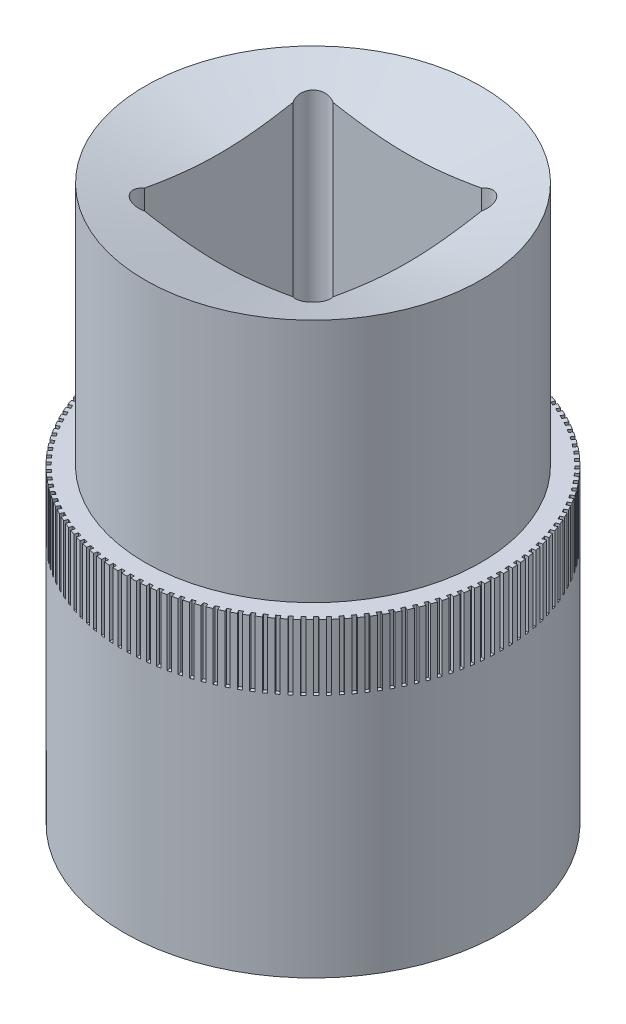
from build123d import *

# Parameters (mm, degrees)
CUT_EXTRUDE1_DEPTH        = 16
CUT_EXTRUDE2_DEPTH        = 18.5
CUT_EXTRUDE3_REACH        = 28.615
CUT_EXTRUDE3_START_RADIUS = 12.925
CUT_EXTRUDE3_END_RADIUS   = 12.925
SKETCH4_W                 = 0.25
SKETCH4_H                 = 4.5
CIRPATTERN1_COUNT         = 130


with BuildPart() as part:
    # Sketch1 → Revolve1 (revolve)
    with BuildSketch(Plane(origin=(0, 0, 0), x_dir=(0, 0, -1), z_dir=(1, 0, 0)), mode=Mode.PRIVATE) as revolve1_sk:
        Polygon((11.5, 19), (11.5, 2.25), (12.925, 2.25), (12.925, -19), (10, -19), (10, -0.8), (6.45, -0.8), (6.45, 17.5), align=None)
    revolve(revolve1_sk.sketch.rotate(Axis((0, 19, 0), (0, -1, 0)), 180), axis=Axis((0, 19, 0), (0, -1, 0)))

    # Sketch2 → Cut-Extrude1 (cut)
    with BuildSketch(Plane(origin=(0, 19, 0), x_dir=(1, 0, 0), z_dir=(0, 1, 0))):
        with BuildLine():
            Line((-5.082405474, 6.45), (5.082405474, 6.45))
            ThreePointArc((5.082405474, 6.45), (6.293250353, 6.293250353), (6.45, 5.082405474))
            Line((6.45, 5.082405474), (6.45, -5.082405474))
            ThreePointArc((6.45, -5.082405474), (6.293250353, -6.293250353), (5.082405474, -6.45))
            Line((5.082405474, -6.45), (-5.082405474, -6.45))
            ThreePointArc((-5.082405474, -6.45), (-6.293250353, -6.293250353), (-6.45, -5.082405474))
            Line((-6.45, -5.082405474), (-6.45, 5.082405474))
            ThreePointArc((-6.45, 5.082405474), (-6.293250353, 6.293250353), (-5.082405474, 6.45))
        make_face()
    extrude(amount=-CUT_EXTRUDE1_DEPTH, mode=Mode.SUBTRACT)

    # Sketch3 → Cut-Extrude2 (cut)
    with BuildSketch(Plane.XZ.offset(19)):
        Polygon((11.1, 0), (9.612881982, 2.575763964), (9.612881982, 5.55), (7.037118018, 7.037118018), (5.55, 9.612881982), (2.575763964, 9.612881982), (0, 11.1), (-2.575763964, 9.612881982), (-5.55, 9.612881982), (-7.037118018, 7.037118018), (-9.612881982, 5.55), (-9.612881982, 2.575763964), (-11.1, 0), (-9.612881982, -2.575763964), (-9.612881982, -5.55), (-7.037118018, -7.037118018), (-5.55, -9.612881982), (-2.575763964, -9.612881982), (0, -11.1), (2.575763964, -9.612881982), (5.55, -9.612881982), (7.037118018, -7.037118018), (9.612881982, -5.55), (9.612881982, -2.575763964), align=None)
    extrude(amount=-CUT_EXTRUDE2_DEPTH, mode=Mode.SUBTRACT)

    # Cut-Extrude3: from a cylinder face, 28.615 long prism both ways, kept between that surface and its translate by the depth
    cut_extrude3_start = Plane(origin=(0, 0, 0), z_dir=(0, 1, 0)) * Cylinder(CUT_EXTRUDE3_START_RADIUS, 84.08, mode=Mode.PRIVATE)
    cut_extrude3_end = Plane(origin=(-0.25, 0, 0), z_dir=(0, 1, 0)) * Cylinder(CUT_EXTRUDE3_END_RADIUS, 84.08, mode=Mode.PRIVATE)
    # Sketch4 → Cut-Extrude3 (cut, from a surface)
    with BuildSketch(Plane(origin=(0, 0, 0), x_dir=(0, 0, -1), z_dir=(1, 0, 0)), mode=Mode.PRIVATE) as cut_extrude3_sk1:
        Rectangle(SKETCH4_W, SKETCH4_H)
    cut_extrude3_tool1 = extrude(cut_extrude3_sk1.sketch, amount=CUT_EXTRUDE3_REACH, both=True, mode=Mode.PRIVATE)
    cut_extrude3 = ((cut_extrude3_tool1 & cut_extrude3_start) - cut_extrude3_end).solids().sort_by_distance((12.799396, 0, 0))[0]
    add(cut_extrude3, mode=Mode.SUBTRACT)

    # CirPattern1: Cut-Extrude3 ×130 about axis
    cirpattern1_axis = Axis((0, 0, 0), (0, 1, 0))
    for i in range(1, CIRPATTERN1_COUNT):
        add(cut_extrude3.rotate(cirpattern1_axis, i * 360 / CIRPATTERN1_COUNT), mode=Mode.SUBTRACT)


solid = part.part
